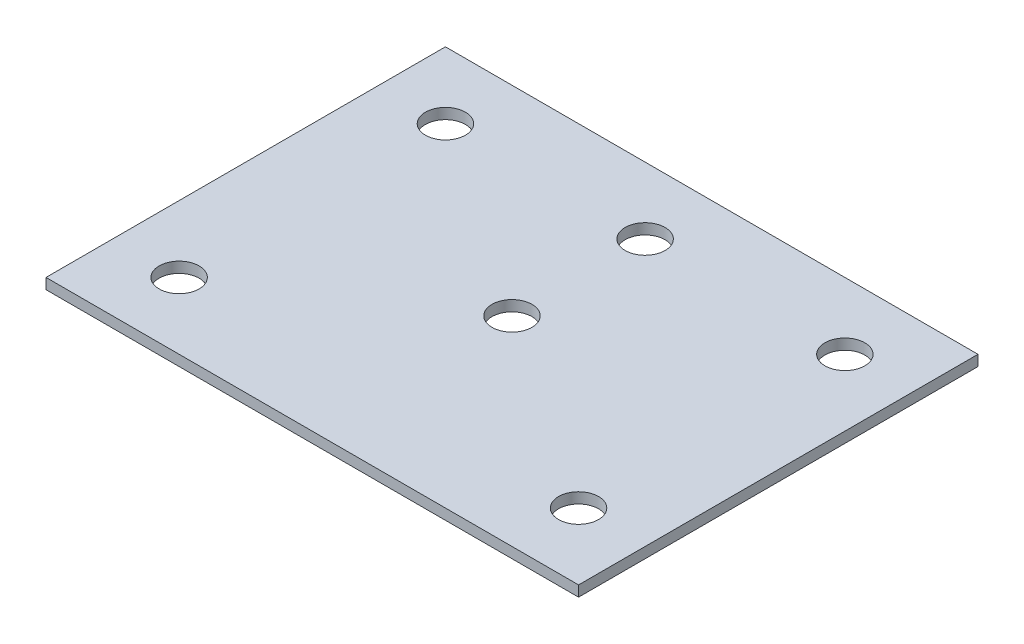
from build123d import *

# Parameters (mm, degrees)
SKETCH_1_W      = 80
SKETCH_1_H      = 60
SKETCH_1_R      = 3
EXTRUDE_1_DEPTH = 1.6


with BuildPart() as part:
    # 草图1 → 凸台-拉伸1 (new body)
    with BuildSketch(Plane(origin=(0, 0, 0), x_dir=(1, 0, 0), z_dir=(0, 1, 0))):
        Rectangle(SKETCH_1_W, SKETCH_1_H)
        with Locations(Location((-30, 20, 0), (0, 0, 270))):
            Circle(SKETCH_1_R, mode=Mode.SUBTRACT)
        with Locations(Location((-30, -20, 0), (0, 0, 270))):
            Circle(SKETCH_1_R, mode=Mode.SUBTRACT)
        with Locations(Location((30, -20, 0), (0, 0, 270))):
            Circle(SKETCH_1_R, mode=Mode.SUBTRACT)
        with Locations(Location((30, 20, 0), (0, 0, 270))):
            Circle(SKETCH_1_R, mode=Mode.SUBTRACT)
        with Locations(Location((0, 20, 0), (0, 0, 270))):
            Circle(SKETCH_1_R, mode=Mode.SUBTRACT)
        with Locations(Location((0, 0, 0), (0, 0, 270))):
            Circle(SKETCH_1_R, mode=Mode.SUBTRACT)
    extrude(amount=EXTRUDE_1_DEPTH)


solid = part.part
